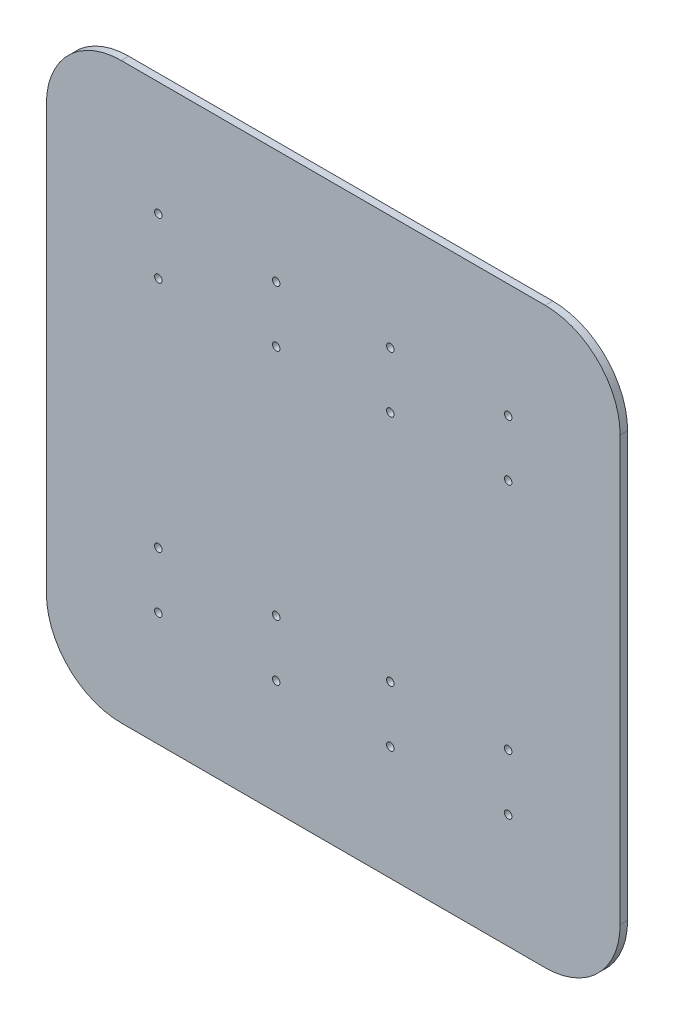
from build123d import *

# Parameters (mm, degrees)
CROQUIS1_W              = 230
CROQUIS1_H              = 230
SALIENTE_EXTRUIR1_DEPTH = 3
REDONDEO1_R             = 30
REDONDEO2_R             = 30
REDONDEO3_R             = 30
REDONDEO4_R             = 30
CROQUIS2_R              = 1.5
CORTAR_EXTRUIR1_DEPTH   = 3


with BuildPart() as part:
    # Croquis1 → Saliente-Extruir1 (new body)
    with BuildSketch(Plane.XY):
        Rectangle(CROQUIS1_W, CROQUIS1_H)
    extrude(amount=SALIENTE_EXTRUIR1_DEPTH)

    # Redondeo1
    redondeo1_edges = [part.edges().sort_by_distance(p)[0] for p in [
        (115, 115, 1.5),
    ]]
    fillet(redondeo1_edges, radius=REDONDEO1_R)

    # Redondeo2
    redondeo2_edges = [part.edges().sort_by_distance(p)[0] for p in [
        (115, -115, 1.5),
    ]]
    fillet(redondeo2_edges, radius=REDONDEO2_R)

    # Redondeo3
    redondeo3_edges = [part.edges().sort_by_distance(p)[0] for p in [
        (-115, -115, 1.5),
    ]]
    fillet(redondeo3_edges, radius=REDONDEO3_R)

    # Redondeo4
    redondeo4_edges = [part.edges().sort_by_distance(p)[0] for p in [
        (-115, 115, 1.5),
    ]]
    fillet(redondeo4_edges, radius=REDONDEO4_R)

    # Croquis2 → Cortar-Extruir1 (cut)
    with BuildSketch(Plane.XY.offset(3)):
        with Locations((-70.125, 69.25)):
            Circle(CROQUIS2_R)
        with Locations((-70.125, 46.75)):
            Circle(CROQUIS2_R)
        with Locations((-22.875, 46.75)):
            Circle(CROQUIS2_R)
        with Locations((22.875, 69.25)):
            Circle(CROQUIS2_R)
        with Locations((22.875, 46.75)):
            Circle(CROQUIS2_R)
        with Locations((70.125, 46.75)):
            Circle(CROQUIS2_R)
        with Locations((70.125, 69.25)):
            Circle(CROQUIS2_R)
        with Locations((70.125, -69.25)):
            Circle(CROQUIS2_R)
        with Locations((70.125, -46.75)):
            Circle(CROQUIS2_R)
        with Locations((22.875, -46.75)):
            Circle(CROQUIS2_R)
        with Locations((22.875, -69.25)):
            Circle(CROQUIS2_R)
        with Locations((-22.875, -69.25)):
            Circle(CROQUIS2_R)
        with Locations((-70.125, -69.25)):
            Circle(CROQUIS2_R)
        with Locations((-70.125, -46.75)):
            Circle(CROQUIS2_R)
        with Locations((-22.875, -46.75)):
            Circle(CROQUIS2_R)
        with Locations(Location((-22.875, 69.25, 0), (0, 0, 180))):
            Circle(CROQUIS2_R)
    extrude(amount=-CORTAR_EXTRUIR1_DEPTH, mode=Mode.SUBTRACT)


solid = part.part
